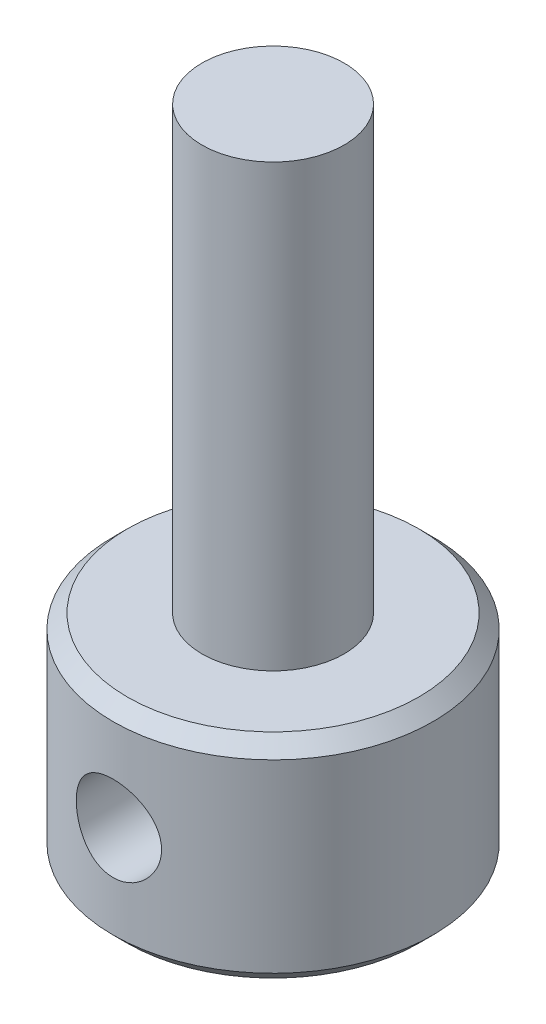
from build123d import *

# Parameters (mm, degrees)
SKETCH_1_R      = 11.25
EXTRUDE_1_DEPTH = 15
SKETCH_2_R      = 5
EXTRUDE_2_DEPTH = 31
CHAMFER_1_SIZE  = 1
F_6_0MM_2_D     = 6


with BuildPart() as part:
    # 草图1 → 凸台-拉伸1 (new body)
    with BuildSketch(Plane(origin=(0, 0, 0), x_dir=(1, 0, 0), z_dir=(0, 1, 0))):
        with Locations(Location((0, 0, 0), (0, 0, 270))):
            Circle(SKETCH_1_R)
    extrude(amount=EXTRUDE_1_DEPTH)

    # 草图2 → 凸台-拉伸2 (add)
    with BuildSketch(Plane(origin=(0, 15, 0), x_dir=(1, 0, 0), z_dir=(0, 1, 0))):
        with Locations(Location((0, 0, 0), (0, 0, 270))):
            Circle(SKETCH_2_R)
    extrude(amount=EXTRUDE_2_DEPTH)

    # 倒角1
    chamfer_1_edges = [part.edges().sort_by_distance(p)[0] for p in [
        (0, 0, -11.25),
        (0, 15, -11.25),
    ]]
    chamfer(chamfer_1_edges, length=CHAMFER_1_SIZE)

    # Ø6.0mm 暗销孔2 (through all)
    with Locations(Plane(origin=(0, 7.5, 11.25), x_dir=(1, 0, 0), z_dir=(0, 0, 1))):
        with Locations((0, 0)):
            Hole(F_6_0MM_2_D / 2)


solid = part.part
